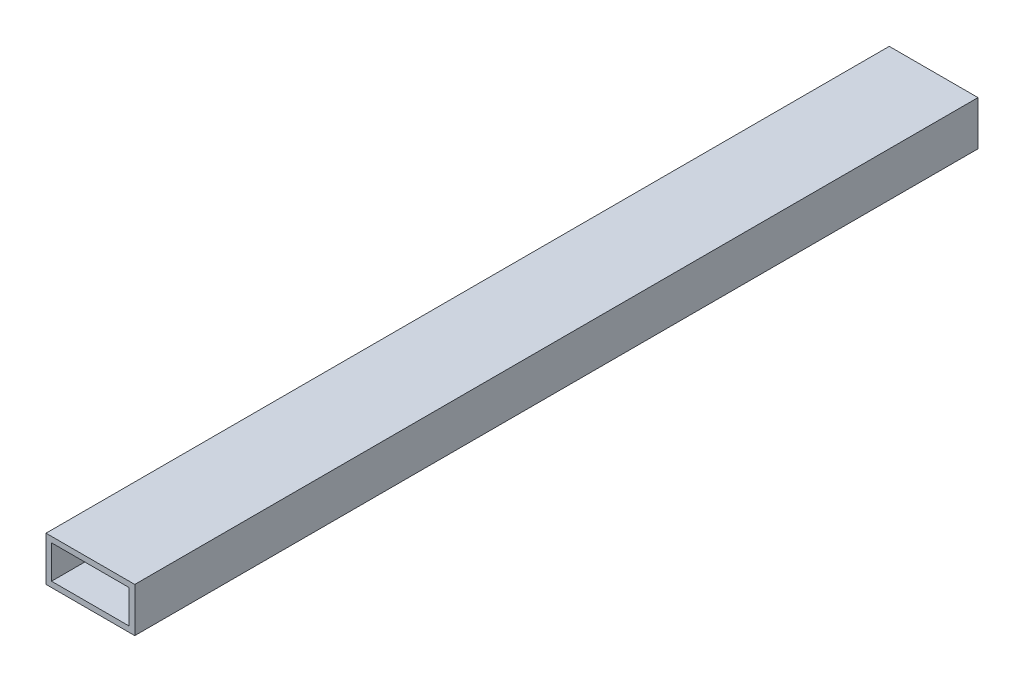
from build123d import *

# Parameters (mm, degrees)
SKETCH1_W           = 50.8
SKETCH1_H           = 25.4
SKETCH1_W_2         = 44.45
SKETCH1_H_2         = 19.05
BOSS_EXTRUDE1_DEPTH = 482.6


with BuildPart() as part:
    # Sketch1 → Boss-Extrude1 (new body)
    with BuildSketch(Plane.XY):
        with Locations((25.4, 12.7)):
            Rectangle(SKETCH1_W, SKETCH1_H)
        with Locations((25.4, 12.7)):
            Rectangle(SKETCH1_W_2, SKETCH1_H_2, mode=Mode.SUBTRACT)
    extrude(amount=BOSS_EXTRUDE1_DEPTH)


solid = part.part
